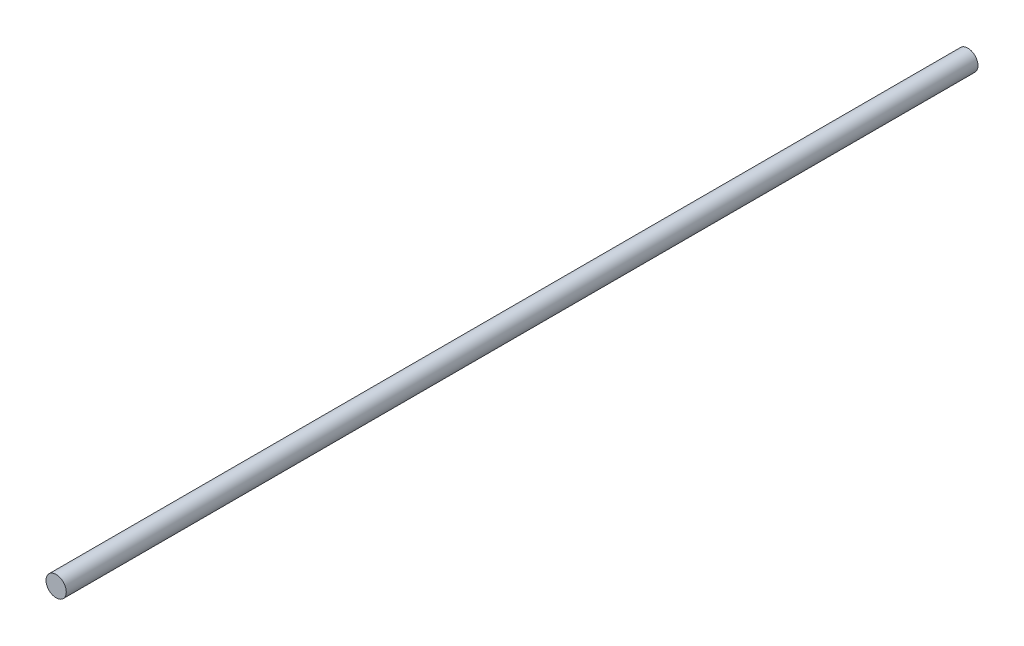
from build123d import *

# Parameters (mm, degrees)
SKETCH1_R           = 5
BOSS_EXTRUDE1_DEPTH = 449


with BuildPart() as part:
    # Sketch1 → Boss-Extrude1 (new body)
    with BuildSketch(Plane.XY):
        Circle(SKETCH1_R)
    extrude(amount=BOSS_EXTRUDE1_DEPTH)


solid = part.part
